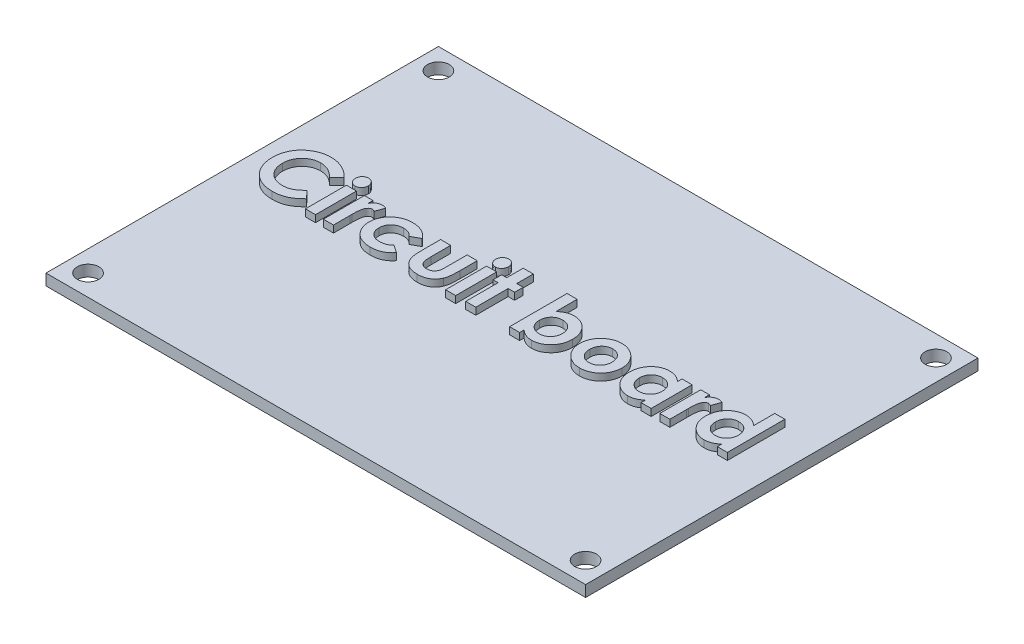
from build123d import *

# Parameters (mm, degrees)
SKETCH_1_W      = 77
SKETCH_1_H      = 56
SKETCH_1_R      = 1.55
EXTRUDE_1_DEPTH = 1.6
SKETCH_2_W      = 1.435897435
SKETCH_2_H      = 5.846153846
EXTRUDE_2_DEPTH = 1


with BuildPart() as part:
    # ｽｹｯﾁ1 → ﾎﾞｽ - 押し出し1 (new body)
    with BuildSketch(Plane(origin=(0, 0, 0), x_dir=(1, 0, 0), z_dir=(0, 1, 0))):
        Rectangle(SKETCH_1_W, SKETCH_1_H)
        with Locations(Location((-35.5, 25, 0), (0, 0, 270))):
            Circle(SKETCH_1_R, mode=Mode.SUBTRACT)
        with Locations(Location((35.5, 25, 0), (0, 0, 270))):
            Circle(SKETCH_1_R, mode=Mode.SUBTRACT)
        with Locations(Location((35.5, -25, 0), (0, 0, 270))):
            Circle(SKETCH_1_R, mode=Mode.SUBTRACT)
        with Locations(Location((-35.5, -25, 0), (0, 0, 270))):
            Circle(SKETCH_1_R, mode=Mode.SUBTRACT)
    extrude(amount=EXTRUDE_1_DEPTH)

    # ｽｹｯﾁ2 → ﾎﾞｽ - 押し出し2 (add)
    # profile 1 of 14: a face of its own
    with BuildSketch(Plane(origin=(0, 1.6, 0), x_dir=(1, 0, 0), z_dir=(0, 1, 0))):
        with BuildLine():
            Line((-28.050815975, 4.060532722), (-29.10370059, 3.054122466))
            add(Edge.make_bspline(
                [(-29.10370059, 3.054122466), (-29.193014841, 3.146473551), (-29.367473554, 3.326864152), (-29.648592194, 3.565685412), (-29.940945343, 3.764710617), (-30.238845856, 3.932328379), (-30.547652099, 4.059143161), (-30.86379343, 4.151555229), (-31.189288505, 4.207895374), (-31.409571052, 4.214341684), (-31.520367257, 4.217584004)],
                knots=[0, 0, 0, 0, 1.115251505, 2.178435587, 3.19620269, 4.182487026, 5.141301733, 6.088180966, 7.038406374, 8, 8, 8, 8], degree=3))
            add(Edge.make_bspline(
                [(-31.520367257, 4.217584004), (-31.612895552, 4.215022458), (-31.795489948, 4.209967528), (-32.063586371, 4.172909904), (-32.320034455, 4.109891803), (-32.565712062, 4.023041187), (-32.799896276, 3.910661099), (-33.023078093, 3.772838518), (-33.234707268, 3.610818179), (-33.431988301, 3.425438382), (-33.612454057, 3.222897024), (-33.771907043, 3.006785877), (-33.905474497, 2.777600041), (-34.015091133, 2.537660542), (-34.100478256, 2.28585682), (-34.161455389, 2.0223584), (-34.196722933, 1.746851475), (-34.201986851, 1.559563921), (-34.204662128, 1.464378876)],
                knots=[0, 0, 0, 0, 1.035432265, 2.043311493, 3.022114605, 3.98653278, 4.95457646, 5.923598177, 6.917315552, 7.932509744, 8.948865224, 9.949768934, 10.933144597, 11.912367597, 12.897413939, 13.903909035, 14.934704909, 16, 16, 16, 16], degree=3))
            add(Edge.make_bspline(
                [(-34.204662128, 1.464378876), (-34.203891144, 1.397571352), (-34.202371518, 1.265892349), (-34.18573652, 1.071102557), (-34.158950252, 0.882110409), (-34.120183886, 0.699202177), (-34.071706163, 0.522219351), (-34.014830757, 0.349635109), (-33.943481395, 0.183834176), (-33.864282528, 0.022890884), (-33.772175158, -0.128803229), (-33.672866422, -0.273456156), (-33.565182311, -0.410358822), (-33.448425349, -0.538951564), (-33.320952328, -0.657224767), (-33.186057953, -0.768735045), (-33.041466743, -0.87069092), (-32.890182223, -0.965651086), (-32.730897487, -1.04814379), (-32.567934299, -1.122866242), (-32.398821808, -1.183551983), (-32.225619061, -1.232470227), (-32.048945023, -1.274067888), (-31.867071658, -1.299680845), (-31.68157558, -1.319077239), (-31.556211367, -1.320274853), (-31.493123667, -1.320877534)],
                knots=[0, 0, 0, 0, 1.103660481, 2.175337485, 3.227646561, 4.255952547, 5.262355991, 6.258840057, 7.255597736, 8.242457506, 9.22035537, 10.185017736, 11.140346927, 12.096287581, 13.051739095, 14.01125915, 14.986044842, 15.97314143, 16.960198552, 17.947847494, 18.933482797, 19.925264591, 20.920966487, 21.929612487, 22.958107872, 24, 24, 24, 24], degree=3))
            add(Edge.make_bspline(
                [(-31.493123667, -1.320877534), (-31.386116085, -1.317782307), (-31.175874014, -1.311700991), (-30.867313544, -1.264145957), (-30.573286156, -1.185920619), (-30.33835968, -1.09354104), (-30.154300991, -1.002315006), (-30.014179832, -0.917935417), (-29.869283633, -0.823547582), (-29.722018996, -0.715589203), (-29.570729485, -0.595355822), (-29.418085709, -0.460214106), (-29.260179961, -0.314614076), (-29.15673747, -0.210696474), (-29.10370059, -0.157415996)],
                knots=[0, 0, 0, 0, 1.404581149, 2.759636711, 4.088442092, 5.392261763, 6.066678138, 6.783632037, 7.538459478, 8.336747902, 9.180226004, 10.074962426, 11.012997595, 12, 12, 12, 12], degree=3))
            Line((-29.10370059, -0.157415996), (-28.082867257, -1.22953138))
            add(Edge.make_bspline(
                [(-28.082867257, -1.22953138), (-28.154626345, -1.298812528), (-28.29468474, -1.434034511), (-28.505958941, -1.626037109), (-28.716967244, -1.798572787), (-28.922612129, -1.957903835), (-29.126262275, -2.099388551), (-29.327896083, -2.223168239), (-29.525230971, -2.332373466), (-29.722364662, -2.425162539), (-29.920523822, -2.503950099), (-30.124406312, -2.571781017), (-30.334635418, -2.629163533), (-30.552495124, -2.675463688), (-30.775953368, -2.712590161), (-31.007101422, -2.737650316), (-31.244473692, -2.754497424), (-31.405486981, -2.756011276), (-31.486713411, -2.75677497)],
                knots=[0, 0, 0, 0, 1.244526981, 2.429050516, 3.560637417, 4.644440555, 5.67424972, 6.652764056, 7.595344123, 8.486817594, 9.369275933, 10.254498637, 11.166417451, 12.086725134, 13.032340136, 13.991389299, 14.986715468, 16, 16, 16, 16], degree=3))
            add(Edge.make_bspline(
                [(-31.486713411, -2.75677497), (-31.6359163, -2.752971491), (-31.92786488, -2.745529139), (-32.355707912, -2.690386353), (-32.762147308, -2.597940444), (-33.148171859, -2.46719643), (-33.513658817, -2.300177079), (-33.858514681, -2.095419197), (-34.182183618, -1.853466794), (-34.482051022, -1.577155787), (-34.75329536, -1.271993476), (-34.993043943, -0.944332872), (-35.191363979, -0.592563643), (-35.356033379, -0.221882545), (-35.484802684, 0.169401984), (-35.575434445, 0.581713195), (-35.631326391, 1.014652976), (-35.637441049, 1.310360826), (-35.640559564, 1.461173748)],
                knots=[0, 0, 0, 0, 1.078019885, 2.10938526, 3.111377082, 4.085535484, 5.04941344, 6.010039228, 6.978205633, 7.964457913, 8.951525778, 9.924444315, 10.892603023, 11.863865945, 12.85144698, 13.863884204, 14.910567087, 16, 16, 16, 16], degree=3))
            add(Edge.make_bspline(
                [(-35.640559564, 1.461173748), (-35.639241831, 1.559532649), (-35.636630405, 1.754455951), (-35.60918408, 2.041593767), (-35.570922306, 2.321501777), (-35.510223482, 2.591273607), (-35.437057035, 2.854543582), (-35.346064946, 3.108450266), (-35.237392541, 3.35372341), (-35.114542588, 3.590773617), (-34.975563666, 3.818047955), (-34.820308952, 4.033593778), (-34.652775309, 4.239075061), (-34.468937176, 4.431765712), (-34.271465962, 4.613357594), (-34.059470108, 4.782866625), (-33.834224662, 4.942723756), (-33.595119969, 5.088806659), (-33.346801196, 5.22094641), (-33.092400296, 5.337499314), (-32.832542302, 5.434910701), (-32.568325918, 5.515709854), (-32.298634833, 5.576020708), (-32.025394033, 5.621674079), (-31.746278567, 5.647194605), (-31.558876712, 5.651372478), (-31.464277513, 5.65348144)],
                knots=[0, 0, 0, 0, 1.071919942, 2.124283339, 3.142214191, 4.149696895, 5.136002878, 6.119640489, 7.086990633, 8.058538607, 9.028339693, 9.988281803, 10.952401235, 11.916291999, 12.888973767, 13.874849856, 14.873389453, 15.898127285, 16.927174885, 17.938320013, 18.946391617, 19.950418109, 20.947802303, 21.956882652, 22.968648068, 24, 24, 24, 24], degree=3))
            add(Edge.make_bspline(
                [(-31.464277513, 5.65348144), (-31.383574697, 5.65227253), (-31.223008148, 5.64986728), (-30.983897613, 5.629816902), (-30.746699373, 5.598327986), (-30.512262669, 5.550817917), (-30.27891057, 5.494417461), (-30.049709585, 5.420568845), (-29.821043945, 5.338250645), (-29.596499929, 5.239856045), (-29.375764109, 5.132449451), (-29.164007567, 5.010592771), (-28.957674932, 4.881784926), (-28.76133841, 4.738402506), (-28.571320195, 4.585646257), (-28.38861391, 4.422803485), (-28.21482291, 4.247159124), (-28.105761327, 4.123056014), (-28.050815975, 4.060532722)],
                knots=[0, 0, 0, 0, 0.996412454, 1.982464992, 2.961075852, 3.949442424, 4.934965278, 5.923860011, 6.921385422, 7.934793307, 8.949617135, 9.951082467, 10.950285876, 11.951772932, 12.951063433, 13.960125323, 14.972308753, 16, 16, 16, 16], degree=3))
        make_face()
    # profile 2 of 14: a face of its own
    with BuildSketch(Plane(origin=(0, 1.6, 0), x_dir=(1, 0, 0), z_dir=(0, 1, 0))):
        with BuildLine():
            add(Edge.make_bspline(
                [(-26.207867257, 5.756045543), (-26.145980087, 5.753009124), (-26.024458668, 5.747046823), (-25.850362697, 5.688927654), (-25.69057788, 5.597711354), (-25.54932367, 5.472560416), (-25.431841627, 5.323107306), (-25.342080982, 5.155784613), (-25.292079067, 4.970396457), (-25.28513454, 4.842332259), (-25.281585205, 4.776878876)],
                knots=[0, 0, 0, 0, 0.989868614, 1.943702388, 2.910836514, 3.924849579, 4.949916355, 5.946401046, 6.950409252, 8, 8, 8, 8], degree=3))
            add(Edge.make_bspline(
                [(-25.281585205, 4.776878876), (-25.285007551, 4.711907849), (-25.291676155, 4.585308708), (-25.343231807, 4.402437284), (-25.429389771, 4.235195859), (-25.547823346, 4.087962405), (-25.687546175, 3.964827097), (-25.843839572, 3.87195482), (-26.016267198, 3.817068807), (-26.135902972, 3.810608091), (-26.196649308, 3.807327594)],
                knots=[0, 0, 0, 0, 1.05296456, 2.051751585, 3.055639087, 4.085634717, 5.099016424, 6.062201612, 7.016062274, 8, 8, 8, 8], degree=3))
            add(Edge.make_bspline(
                [(-26.196649308, 3.807327594), (-26.259076701, 3.810353158), (-26.381655352, 3.816293973), (-26.557179268, 3.874549128), (-26.719095206, 3.96504704), (-26.859736656, 4.092755006), (-26.978564131, 4.243270093), (-27.064403995, 4.414488204), (-27.118098954, 4.601144039), (-27.124472498, 4.731104955), (-27.127739052, 4.797712209)],
                knots=[0, 0, 0, 0, 0.989065327, 1.942068821, 2.907541208, 3.917690034, 4.939857478, 5.938239964, 6.943311734, 8, 8, 8, 8], degree=3))
            add(Edge.make_bspline(
                [(-27.127739052, 4.797712209), (-27.124184148, 4.86157999), (-27.117201054, 4.987039024), (-27.066899621, 5.168305458), (-26.979197186, 5.332815195), (-26.862561377, 5.479532426), (-26.722547855, 5.602348828), (-26.562858958, 5.690794829), (-26.38993466, 5.746513511), (-26.269183035, 5.752835391), (-26.207867257, 5.756045543)],
                knots=[0, 0, 0, 0, 1.038616768, 2.040212704, 3.031499824, 4.052181184, 5.074969369, 6.039807101, 7.004644834, 8, 8, 8, 8], degree=3))
        make_face()
    # profile 3 of 14: a face of its own
    with BuildSketch(Plane(origin=(0, 1.6, 0), x_dir=(1, 0, 0), z_dir=(0, 1, 0))):
        with Locations((-26.204662129, 0.371430158)):
            Rectangle(SKETCH_2_W, SKETCH_2_H)
    # profile 4 of 14: a face of its own
    with BuildSketch(Plane(origin=(0, 1.6, 0), x_dir=(1, 0, 0), z_dir=(0, 1, 0))):
        with BuildLine():
            Line((-24.358508282, 3.294507081), (-23.127739052, 3.294507081))
            Line((-23.127739052, 3.294507081), (-23.127739052, 2.574955799))
            add(Edge.make_bspline(
                [(-23.127739052, 2.574955799), (-23.092922953, 2.63890252), (-23.024873443, 2.763889038), (-22.899860787, 2.931658686), (-22.756241185, 3.072949604), (-22.599175332, 3.190717018), (-22.428187193, 3.282505154), (-22.247855526, 3.347915772), (-22.059723065, 3.39042361), (-21.931385478, 3.39483937), (-21.866521103, 3.397071184)],
                knots=[0, 0, 0, 0, 1.09866127, 2.147379032, 3.14564304, 4.131443017, 5.102343063, 6.064490016, 7.021754664, 8, 8, 8, 8], degree=3))
            add(Edge.make_bspline(
                [(-21.866521103, 3.397071184), (-21.819421473, 3.394865686), (-21.723509807, 3.390374505), (-21.577326933, 3.364267199), (-21.429034896, 3.317060227), (-21.331445957, 3.274556622), (-21.281585205, 3.252840415)],
                knots=[0, 0, 0, 0, 0.931404136, 1.896671404, 2.925354185, 4, 4, 4, 4], degree=3))
            Line((-21.281585205, 3.252840415), (-21.727098026, 2.036494261))
            add(Edge.make_bspline(
                [(-21.727098026, 2.036494261), (-21.76692051, 2.05573456), (-21.841771451, 2.091898915), (-21.95044202, 2.13457658), (-22.049065067, 2.160616406), (-22.111590269, 2.164501776), (-22.140559564, 2.166301953)],
                knots=[0, 0, 0, 0, 1.214386998, 2.282580073, 3.20428172, 4, 4, 4, 4], degree=3))
            add(Edge.make_bspline(
                [(-22.140559564, 2.166301953), (-22.167912213, 2.165109061), (-22.221719586, 2.162762436), (-22.301137764, 2.142652656), (-22.375933149, 2.107973965), (-22.449710127, 2.06354712), (-22.516648513, 2.001790482), (-22.583545553, 1.930296209), (-22.642498806, 1.842027019), (-22.704711586, 1.743778928), (-22.757683543, 1.623523353), (-22.803105365, 1.479962979), (-22.843576573, 1.311436712), (-22.87142629, 1.117049761), (-22.89834416, 0.898683156), (-22.914366336, 0.654734112), (-22.926307868, 0.38597402), (-22.927038012, 0.198369776), (-22.927418539, 0.100596825)],
                knots=[0, 0, 0, 0, 0.544232178, 1.070598461, 1.618251235, 2.182094276, 2.777567932, 3.425210017, 4.127676488, 4.886675562, 5.738955394, 6.734782583, 7.883056018, 9.186093582, 10.642914445, 12.264202625, 14.053029461, 16, 16, 16, 16], degree=3))
            Line((-22.927418539, 0.100596825), (-22.922610846, -0.184659585))
            Line((-22.922610846, -0.184659585), (-22.922610846, -2.551646765))
            Line((-22.922610846, -2.551646765), (-24.358508282, -2.551646765))
            Line((-24.358508282, -2.551646765), (-24.358508282, 3.294507081))
        make_face()
    # profile 5 of 14: a face of its own
    with BuildSketch(Plane(origin=(0, 1.6, 0), x_dir=(1, 0, 0), z_dir=(0, 1, 0))):
        with BuildLine():
            Line((-14.922610846, 2.102199389), (-16.111713411, 1.448353235))
            add(Edge.make_bspline(
                [(-16.111713411, 1.448353235), (-16.166217538, 1.502934317), (-16.270988174, 1.607852878), (-16.43899631, 1.740663132), (-16.604002361, 1.850626327), (-16.772808843, 1.931773516), (-16.946924687, 1.992885128), (-17.132630039, 2.033360691), (-17.332092408, 2.060012411), (-17.470060756, 2.062470434), (-17.54120059, 2.06373785)],
                knots=[0, 0, 0, 0, 1.150764855, 2.212059359, 3.192108068, 4.105322427, 5.000809612, 5.941206042, 6.938435785, 8, 8, 8, 8], degree=3))
            add(Edge.make_bspline(
                [(-17.54120059, 2.06373785), (-17.606440728, 2.06216206), (-17.734110206, 2.059078371), (-17.920655574, 2.036045328), (-18.09794783, 1.999869201), (-18.265668725, 1.946943401), (-18.423519532, 1.877025537), (-18.572805609, 1.794288263), (-18.712076287, 1.695499971), (-18.839362938, 1.582064913), (-18.954261513, 1.457175428), (-19.056756903, 1.323975426), (-19.140724833, 1.180488914), (-19.213320316, 1.030088348), (-19.266693401, 0.869948868), (-19.305742448, 0.701523572), (-19.328000041, 0.524804999), (-19.331224774, 0.404076023), (-19.332867257, 0.342584004)],
                knots=[0, 0, 0, 0, 1.121765476, 2.195200973, 3.227634963, 4.230038321, 5.213228299, 6.192116585, 7.160777141, 8.14345191, 9.118668839, 10.075979138, 11.027630062, 11.972829041, 12.943187208, 13.923755399, 14.94248691, 16, 16, 16, 16], degree=3))
            add(Edge.make_bspline(
                [(-19.332867257, 0.342584004), (-19.331131832, 0.282696724), (-19.327743292, 0.165762568), (-19.306925245, -0.006041573), (-19.270784333, -0.169591785), (-19.216595765, -0.324023424), (-19.151644708, -0.470760132), (-19.070078072, -0.608634881), (-18.9741602, -0.738249738), (-18.863386126, -0.858478159), (-18.740676562, -0.966608872), (-18.608386031, -1.062099487), (-18.466909233, -1.143057862), (-18.314598104, -1.206591991), (-18.153935924, -1.258359015), (-17.983849785, -1.295219163), (-17.804520688, -1.315679095), (-17.682276582, -1.319117935), (-17.619726231, -1.320877534)],
                knots=[0, 0, 0, 0, 1.070556293, 2.090336998, 3.088792742, 4.058148387, 5.011235098, 5.952916408, 6.915475435, 7.888633318, 8.869583867, 9.83422472, 10.800707077, 11.776204622, 12.778807041, 13.814557445, 14.881744048, 16, 16, 16, 16], degree=3))
            add(Edge.make_bspline(
                [(-17.619726231, -1.320877534), (-17.542711757, -1.319115218), (-17.392390695, -1.315675432), (-17.173867496, -1.286500278), (-16.968240156, -1.238254831), (-16.775486868, -1.171479302), (-16.595877299, -1.084169053), (-16.42987294, -0.977526097), (-16.275767274, -0.852337124), (-16.185901339, -0.754736981), (-16.140559564, -0.705492919)],
                knots=[0, 0, 0, 0, 1.116373375, 2.178998604, 3.189797796, 4.174590301, 5.13072713, 6.078291395, 7.030403691, 8, 8, 8, 8], degree=3))
            Line((-16.140559564, -0.705492919), (-15.025174949, -1.47151856))
            add(Edge.make_bspline(
                [(-15.025174949, -1.47151856), (-15.102488053, -1.566043606), (-15.255059585, -1.752581598), (-15.521254601, -1.993022259), (-15.80776084, -2.199614213), (-16.120340561, -2.364513292), (-16.454441571, -2.49566943), (-16.812674548, -2.588383798), (-17.194433567, -2.642960796), (-17.456618944, -2.650400902), (-17.590880077, -2.654210867)],
                knots=[0, 0, 0, 0, 0.997876357, 1.969233105, 2.924898516, 3.881013542, 4.852507933, 5.855329832, 6.901747111, 8, 8, 8, 8], degree=3))
            add(Edge.make_bspline(
                [(-17.590880077, -2.654210867), (-17.711723424, -2.651417328), (-17.947743805, -2.645961237), (-18.291737646, -2.604177875), (-18.615281716, -2.533799489), (-18.919041595, -2.436058377), (-19.202740342, -2.309447036), (-19.465457896, -2.152401667), (-19.708966282, -1.969290698), (-19.928871632, -1.759249121), (-20.125077662, -1.530616597), (-20.296366234, -1.289830198), (-20.444504426, -1.041204114), (-20.560718692, -0.780600061), (-20.655697778, -0.512079995), (-20.719843671, -0.232434141), (-20.762151838, 0.056034022), (-20.766542666, 0.25161894), (-20.768764693, 0.350596825)],
                knots=[0, 0, 0, 0, 1.183377041, 2.311265848, 3.387807024, 4.421911742, 5.431260577, 6.423665966, 7.413571885, 8.409103097, 9.395976332, 10.359992013, 11.300391101, 12.225292883, 13.150239058, 14.085544813, 15.031169026, 16, 16, 16, 16], degree=3))
            add(Edge.make_bspline(
                [(-20.768764693, 0.350596825), (-20.767574337, 0.419555557), (-20.765216608, 0.556141602), (-20.745089062, 0.758987111), (-20.713777364, 0.958390413), (-20.666719577, 1.152951801), (-20.608846807, 1.343615216), (-20.538494619, 1.530342332), (-20.452888061, 1.712169606), (-20.357393688, 1.890643768), (-20.248556696, 2.061053366), (-20.129817796, 2.223323187), (-20.00134428, 2.376459405), (-19.861626909, 2.519034832), (-19.711639881, 2.652069651), (-19.553563619, 2.778262893), (-19.382282851, 2.891106483), (-19.20375196, 2.9972003), (-19.016433084, 3.091644232), (-18.8224792, 3.173161796), (-18.623389137, 3.242422723), (-18.418685685, 3.298109907), (-18.209247475, 3.344006355), (-17.993210875, 3.373134128), (-17.772363225, 3.393607414), (-17.622979977, 3.395909633), (-17.547610846, 3.397071184)],
                knots=[0, 0, 0, 0, 1.00272354, 1.986087015, 2.96193297, 3.936200312, 4.894695956, 5.858592327, 6.835334787, 7.815655071, 8.800643866, 9.773423113, 10.738352213, 11.705312252, 12.673769326, 13.65298065, 14.64420052, 15.654211674, 16.672258995, 17.692438602, 18.712115155, 19.735602823, 20.776372304, 21.827874031, 22.90408564, 24, 24, 24, 24], degree=3))
            add(Edge.make_bspline(
                [(-17.547610846, 3.397071184), (-17.477602593, 3.396279681), (-17.339531515, 3.39471867), (-17.135631743, 3.37839613), (-16.937293942, 3.350671579), (-16.744180579, 3.313993166), (-16.55570517, 3.268542225), (-16.374393787, 3.207957643), (-16.197767596, 3.139196423), (-15.970271197, 3.035374162), (-15.702094581, 2.880402632), (-15.407708505, 2.658139296), (-15.145227681, 2.39812361), (-14.997210869, 2.201365086), (-14.922610846, 2.102199389)],
                knots=[0, 0, 0, 0, 0.826738014, 1.630502179, 2.413926014, 3.191023582, 3.95155221, 4.701751672, 5.446919844, 6.189438973, 7.653650558, 9.094719814, 10.535747635, 12, 12, 12, 12], degree=3))
        make_face()
    # profile 6 of 14: a face of its own
    with BuildSketch(Plane(origin=(0, 1.6, 0), x_dir=(1, 0, 0), z_dir=(0, 1, 0))):
        with BuildLine():
            Line((-13.486713411, 3.294507081), (-12.050815975, 3.294507081))
            Line((-12.050815975, 3.294507081), (-12.050815975, 0.488417338))
            add(Edge.make_bspline(
                [(-12.050815975, 0.488417338), (-12.050688466, 0.422705489), (-12.050443746, 0.296588405), (-12.043633992, 0.115459581), (-12.034078561, -0.050174435), (-12.022154029, -0.200508955), (-12.004355901, -0.335182374), (-11.983808712, -0.453937598), (-11.960514829, -0.557630271), (-11.922636033, -0.673209581), (-11.863373973, -0.799688906), (-11.773877772, -0.933961563), (-11.665471769, -1.05006815), (-11.539620603, -1.149039054), (-11.395039023, -1.227030299), (-11.233718986, -1.279883776), (-11.057690225, -1.315406808), (-10.935086457, -1.319005898), (-10.871328795, -1.320877534)],
                knots=[0, 0, 0, 0, 1.267339619, 2.432334223, 3.495366327, 4.467371443, 5.340232306, 6.114347373, 6.791623365, 7.387877112, 8.457231658, 9.474542289, 10.487879852, 11.508108106, 12.54995813, 13.638205937, 14.771795776, 16, 16, 16, 16], degree=3))
            add(Edge.make_bspline(
                [(-10.871328795, -1.320877534), (-10.807627713, -1.318741327), (-10.684706871, -1.314619192), (-10.507506923, -1.282473691), (-10.345806914, -1.227391304), (-10.197946081, -1.152678547), (-10.068284849, -1.052688248), (-9.955394117, -0.933542712), (-9.86034277, -0.793319976), (-9.814666215, -0.688717834), (-9.79120059, -0.634980098)],
                knots=[0, 0, 0, 0, 1.116871431, 2.155171802, 3.144773418, 4.104381479, 5.046960687, 6.001340237, 6.973219418, 8, 8, 8, 8], degree=3))
            add(Edge.make_bspline(
                [(-9.79120059, -0.634980098), (-9.782589494, -0.611109314), (-9.763581493, -0.558417312), (-9.746663996, -0.467516357), (-9.728455731, -0.360313398), (-9.714052347, -0.23462373), (-9.705902404, -0.09122576), (-9.697170575, 0.070061241), (-9.692720677, 0.249076643), (-9.692143609, 0.374633578), (-9.691841616, 0.440340415)],
                knots=[0, 0, 0, 0, 0.56094539, 1.238222264, 2.041156151, 2.969685991, 4.036367568, 5.220421584, 6.545382566, 8, 8, 8, 8], degree=3))
            Line((-9.691841616, 0.440340415), (-9.691841616, 3.294507081))
            Line((-9.691841616, 3.294507081), (-8.25594418, 3.294507081))
            Line((-8.25594418, 3.294507081), (-8.25594418, 0.837776312))
            add(Edge.make_bspline(
                [(-8.25594418, 0.837776312), (-8.256192804, 0.715966391), (-8.256669492, 0.482419903), (-8.270331075, 0.147405057), (-8.289185608, -0.157190306), (-8.313466619, -0.432204831), (-8.348452556, -0.677752652), (-8.391399658, -0.893257953), (-8.438912864, -1.080144821), (-8.482484245, -1.190876582), (-8.502739052, -1.242351893)],
                knots=[0, 0, 0, 0, 1.388070971, 2.661352173, 3.82033814, 4.865898334, 5.806910977, 6.645039373, 7.370126333, 8, 8, 8, 8], degree=3))
            add(Edge.make_bspline(
                [(-8.502739052, -1.242351893), (-8.528700497, -1.297755232), (-8.579946159, -1.407116663), (-8.66886691, -1.562604399), (-8.76472846, -1.70991671), (-8.872091938, -1.845586009), (-8.988765724, -1.970991157), (-9.111451815, -2.088982918), (-9.245675356, -2.194756489), (-9.387955435, -2.291033722), (-9.540277372, -2.37649821), (-9.701597874, -2.452234223), (-9.873660266, -2.51387035), (-10.054972561, -2.566115662), (-10.246370492, -2.605077678), (-10.44746851, -2.634588433), (-10.65848717, -2.649839703), (-10.802397988, -2.652729939), (-10.876136487, -2.654210867)],
                knots=[0, 0, 0, 0, 0.997311338, 1.968606903, 2.91805772, 3.860812155, 4.785445165, 5.709667791, 6.633356648, 7.568312411, 8.508286151, 9.478643871, 10.470653671, 11.485274776, 12.552984541, 13.653035246, 14.797438149, 16, 16, 16, 16], degree=3))
            add(Edge.make_bspline(
                [(-10.876136487, -2.654210867), (-10.955794788, -2.653261551), (-11.111659069, -2.65140406), (-11.339374607, -2.628657075), (-11.556390576, -2.599225434), (-11.760284007, -2.549186249), (-11.953902365, -2.49121335), (-12.135022804, -2.417224511), (-12.304385425, -2.3302346), (-12.462323474, -2.230759342), (-12.60761204, -2.117887152), (-12.743481776, -1.99649704), (-12.865546225, -1.86175928), (-12.977790293, -1.717834626), (-13.078961273, -1.56339847), (-13.169109381, -1.398999939), (-13.248310976, -1.223891266), (-13.290568956, -1.10116509), (-13.312033923, -1.038826252)],
                knots=[0, 0, 0, 0, 1.211240017, 2.369985978, 3.478996442, 4.539426614, 5.559871561, 6.551301256, 7.510778031, 8.453136967, 9.386094087, 10.30661716, 11.221130616, 12.147659962, 13.080758632, 14.026335491, 14.997475882, 16, 16, 16, 16], degree=3))
            add(Edge.make_bspline(
                [(-13.312033923, -1.038826252), (-13.326678024, -0.990411524), (-13.35822483, -0.886114915), (-13.392285715, -0.712786123), (-13.41952885, -0.513014985), (-13.44603011, -0.286604998), (-13.464517874, -0.033176587), (-13.476601695, 0.246867773), (-13.48476636, 0.554075705), (-13.486045273, 0.767792025), (-13.486713411, 0.879442979)],
                knots=[0, 0, 0, 0, 0.627914866, 1.352675004, 2.190563461, 3.132055958, 4.183353232, 5.345633452, 6.613289997, 8, 8, 8, 8], degree=3))
            Line((-13.486713411, 0.879442979), (-13.486713411, 3.294507081))
        make_face()
    # profile 7 of 14: a face of its own
    with BuildSketch(Plane(origin=(0, 1.6, 0), x_dir=(1, 0, 0), z_dir=(0, 1, 0))):
        with BuildLine():
            add(Edge.make_bspline(
                [(-6.207867257, 5.756045543), (-6.145980087, 5.753009124), (-6.024458668, 5.747046823), (-5.850362697, 5.688927654), (-5.69057788, 5.597711354), (-5.54932367, 5.472560416), (-5.431841627, 5.323107306), (-5.342080982, 5.155784613), (-5.292079067, 4.970396457), (-5.28513454, 4.842332259), (-5.281585205, 4.776878876)],
                knots=[0, 0, 0, 0, 0.989868614, 1.943702388, 2.910836514, 3.924849579, 4.949916355, 5.946401046, 6.950409252, 8, 8, 8, 8], degree=3))
            add(Edge.make_bspline(
                [(-5.281585205, 4.776878876), (-5.285007551, 4.711907849), (-5.291676155, 4.585308708), (-5.343231807, 4.402437284), (-5.429389771, 4.235195859), (-5.547823346, 4.087962405), (-5.687546175, 3.964827097), (-5.843839572, 3.87195482), (-6.016267198, 3.817068807), (-6.135902972, 3.810608091), (-6.196649308, 3.807327594)],
                knots=[0, 0, 0, 0, 1.05296456, 2.051751585, 3.055639087, 4.085634717, 5.099016424, 6.062201612, 7.016062274, 8, 8, 8, 8], degree=3))
            add(Edge.make_bspline(
                [(-6.196649308, 3.807327594), (-6.259076701, 3.810353158), (-6.381655352, 3.816293973), (-6.557179268, 3.874549128), (-6.719095206, 3.96504704), (-6.859736656, 4.092755006), (-6.978564131, 4.243270093), (-7.064403995, 4.414488204), (-7.118098954, 4.601144039), (-7.124472498, 4.731104955), (-7.127739052, 4.797712209)],
                knots=[0, 0, 0, 0, 0.989065327, 1.942068821, 2.907541208, 3.917690034, 4.939857478, 5.938239964, 6.943311734, 8, 8, 8, 8], degree=3))
            add(Edge.make_bspline(
                [(-7.127739052, 4.797712209), (-7.124184148, 4.86157999), (-7.117201054, 4.987039024), (-7.066899621, 5.168305458), (-6.979197186, 5.332815195), (-6.862561377, 5.479532426), (-6.722547855, 5.602348828), (-6.562858958, 5.690794829), (-6.38993466, 5.746513511), (-6.269183035, 5.752835391), (-6.207867257, 5.756045543)],
                knots=[0, 0, 0, 0, 1.038616768, 2.040212704, 3.031499824, 4.052181184, 5.074969369, 6.039807101, 7.004644834, 8, 8, 8, 8], degree=3))
        make_face()
    # profile 8 of 14: a face of its own
    with BuildSketch(Plane(origin=(0, 1.6, 0), x_dir=(1, 0, 0), z_dir=(0, 1, 0))):
        with Locations((-6.204662129, 0.371430158)):
            Rectangle(SKETCH_2_W, SKETCH_2_H)
    # profile 9 of 14: a face of its own
    with BuildSketch(Plane(origin=(0, 1.6, 0), x_dir=(1, 0, 0), z_dir=(0, 1, 0))):
        Polygon((-4.050815975, 5.65348144), (-2.614918539, 5.65348144), (-2.614918539, 3.294507081), (-1.691841616, 3.294507081), (-1.691841616, 2.06373785), (-2.614918539, 2.06373785), (-2.614918539, -2.551646765), (-4.050815975, -2.551646765), (-4.050815975, 2.06373785), (-4.768764693, 2.06373785), (-4.768764693, 3.294507081), (-4.050815975, 3.294507081), align=None)
    # profile 10 of 14: a face of its own
    with BuildSketch(Plane(origin=(0, 1.6, 0), x_dir=(1, 0, 0), z_dir=(0, 1, 0))):
        with BuildLine():
            Line((3.641491718, 5.65348144), (3.641491718, 2.613417338))
            add(Edge.make_bspline(
                [(3.641491718, 2.613417338), (3.708168228, 2.67619729), (3.839057767, 2.799437681), (4.052763646, 2.958800994), (4.274137484, 3.093302324), (4.502980961, 3.206142648), (4.74135369, 3.289583202), (4.986326831, 3.354419638), (5.240410553, 3.388758382), (5.412236637, 3.394284943), (5.498863513, 3.397071184)],
                knots=[0, 0, 0, 0, 1.061187343, 2.083167259, 3.083809127, 4.061667593, 5.035358583, 6.007314429, 6.995378812, 8, 8, 8, 8], degree=3))
            add(Edge.make_bspline(
                [(5.498863513, 3.397071184), (5.5930281, 3.394815705), (5.778501784, 3.390373142), (6.051391019, 3.348895441), (6.312906077, 3.281849591), (6.564044184, 3.188235311), (6.803467302, 3.066692803), (7.033865523, 2.921168599), (7.251265357, 2.74565757), (7.45577249, 2.546861903), (7.644946683, 2.328967083), (7.809493392, 2.092069169), (7.946554414, 1.839286192), (8.062720365, 1.573606574), (8.147502942, 1.290624107), (8.212846278, 0.994134811), (8.249259252, 0.681630324), (8.254304395, 0.468740328), (8.256876333, 0.360212209)],
                knots=[0, 0, 0, 0, 0.985987466, 1.942075377, 2.884088208, 3.810275091, 4.743821533, 5.692411115, 6.659945104, 7.665215984, 8.677116751, 9.678438675, 10.680260931, 11.685531812, 12.710472044, 13.769734641, 14.863044265, 16, 16, 16, 16], degree=3))
            add(Edge.make_bspline(
                [(8.256876333, 0.360212209), (8.254442165, 0.255399298), (8.249643884, 0.04878994), (8.210876794, -0.2545296), (8.145169824, -0.544285745), (8.052996261, -0.82058285), (7.935818829, -1.084294062), (7.792795685, -1.335237667), (7.623092546, -1.572537128), (7.429078064, -1.792995778), (7.217089049, -1.992637475), (6.99621169, -2.17175577), (6.762046836, -2.318529167), (6.520448087, -2.442490544), (6.267609345, -2.537281411), (6.00525761, -2.603693067), (5.733808384, -2.648093379), (5.549255973, -2.652151395), (5.455594282, -2.654210867)],
                knots=[0, 0, 0, 0, 1.098553145, 2.165490463, 3.199345634, 4.208780719, 5.21409072, 6.219899742, 7.23156933, 8.267303578, 9.293302409, 10.281606823, 11.243293419, 12.184993323, 13.124258899, 14.066907486, 15.018941492, 16, 16, 16, 16], degree=3))
            add(Edge.make_bspline(
                [(5.455594282, -2.654210867), (5.372162778, -2.651980523), (5.207880082, -2.647588813), (4.96572055, -2.615016511), (4.733014032, -2.560236175), (4.50682089, -2.484775908), (4.286527391, -2.381674998), (4.068297118, -2.252760797), (3.850725587, -2.096402244), (3.712640279, -1.975909983), (3.641491718, -1.913826252)],
                knots=[0, 0, 0, 0, 0.996418773, 1.962021009, 2.912343664, 3.848616743, 4.805003894, 5.811808768, 6.872532775, 8, 8, 8, 8], degree=3))
            Line((3.641491718, -1.913826252), (3.641491718, -2.551646765))
            Line((3.641491718, -2.551646765), (2.205594282, -2.551646765))
            Line((2.205594282, -2.551646765), (2.205594282, 5.65348144))
            Line((2.205594282, 5.65348144), (3.641491718, 5.65348144))
        make_face()
        with BuildLine():
            add(Edge.make_bspline(
                [(5.187966077, 2.06373785), (5.129693075, 2.061945916), (5.015446313, 2.058432749), (4.847711259, 2.038298808), (4.688779342, 2.00041665), (4.536234131, 1.951317494), (4.392007287, 1.885041345), (4.254918871, 1.804701029), (4.12614306, 1.708901335), (4.005011508, 1.601435813), (3.896165178, 1.480536898), (3.799464656, 1.351350138), (3.719238692, 1.212193275), (3.652361607, 1.064830805), (3.601905768, 0.907668278), (3.564482153, 0.74204268), (3.544144791, 0.567446443), (3.540694179, 0.448401596), (3.538927615, 0.387455799)],
                knots=[0, 0, 0, 0, 1.060469436, 2.079096586, 3.066888298, 4.028858836, 4.99004353, 5.948472697, 6.914558426, 7.905691313, 8.889602648, 9.869280844, 10.836099585, 11.806137001, 12.808075328, 13.83377171, 14.890985086, 16, 16, 16, 16], degree=3))
            add(Edge.make_bspline(
                [(3.538927615, 0.387455799), (3.540716408, 0.325443401), (3.54422699, 0.203741399), (3.564394814, 0.02542213), (3.601555753, -0.143521713), (3.653074286, -0.30347317), (3.718813368, -0.454452994), (3.79894428, -0.597020889), (3.896709224, -0.728051126), (4.004359837, -0.852137624), (4.126240375, -0.961041058), (4.254436049, -1.058712457), (4.391973982, -1.13917253), (4.536890091, -1.204364207), (4.688084765, -1.258538134), (4.847811094, -1.2951434), (5.015419822, -1.315650735), (5.129684127, -1.319112048), (5.187966077, -1.320877534)],
                knots=[0, 0, 0, 0, 1.117193555, 2.192540452, 3.22680955, 4.227918444, 5.21468246, 6.188555072, 7.166222992, 8.154674427, 9.142376254, 10.104580718, 11.053462639, 12.005072638, 12.963662044, 13.941614018, 14.950094269, 16, 16, 16, 16], degree=3))
            add(Edge.make_bspline(
                [(5.187966077, -1.320877534), (5.244128039, -1.319237451), (5.355296507, -1.315991028), (5.517954809, -1.293338626), (5.674309962, -1.256322348), (5.823137498, -1.203560763), (5.965343387, -1.134865233), (6.102222233, -1.054480092), (6.229048462, -0.954044861), (6.350797678, -0.843657967), (6.459730701, -0.719173299), (6.557456714, -0.586924734), (6.639549468, -0.445731928), (6.704729181, -0.295126665), (6.758615108, -0.137961626), (6.79540473, 0.028639851), (6.815645706, 0.20319073), (6.819183505, 0.322234682), (6.820978897, 0.382648107)],
                knots=[0, 0, 0, 0, 1.021711385, 2.02240246, 2.981887075, 3.941027022, 4.888772411, 5.852236371, 6.822344989, 7.82661704, 8.838806642, 9.826383926, 10.814965113, 11.80282933, 12.807900643, 13.833672313, 14.900613836, 16, 16, 16, 16], degree=3))
            add(Edge.make_bspline(
                [(6.820978897, 0.382648107), (6.819154833, 0.442518014), (6.815560917, 0.560478493), (6.795734434, 0.733575831), (6.757528355, 0.897755209), (6.709288318, 1.054357855), (6.641892662, 1.201345208), (6.562204093, 1.340456107), (6.468435729, 1.472110587), (6.359660386, 1.59275462), (6.240353006, 1.702532024), (6.112994411, 1.799631042), (5.978084748, 1.882289973), (5.833786844, 1.947475902), (5.683505901, 2.001109874), (5.524945313, 2.038053662), (5.358911188, 2.058500421), (5.245713095, 2.061968593), (5.187966077, 2.06373785)],
                knots=[0, 0, 0, 0, 1.094680664, 2.156827393, 3.177782763, 4.17210342, 5.146667393, 6.126451192, 7.099203661, 8.094961544, 9.09004898, 10.058676268, 11.018205477, 11.974998356, 12.947750825, 13.930643515, 14.944335875, 16, 16, 16, 16], degree=3))
        make_face(mode=Mode.SUBTRACT)
    # profile 11 of 14: a face of its own
    with BuildSketch(Plane(origin=(0, 1.6, 0), x_dir=(1, 0, 0), z_dir=(0, 1, 0))):
        with BuildLine():
            add(Edge.make_bspline(
                [(12.272901974, 3.397071184), (12.340788433, 3.395863098), (12.475234382, 3.39347054), (12.675474828, 3.373554682), (12.872214609, 3.341061139), (13.066584559, 3.298987673), (13.256779772, 3.240036454), (13.443797799, 3.169333582), (13.629310818, 3.088158417), (13.808714433, 2.991531577), (13.983304701, 2.886730957), (14.148826666, 2.771127274), (14.303905782, 2.645628556), (14.451420845, 2.513144589), (14.584497415, 2.367907454), (14.711639799, 2.216915285), (14.825978803, 2.05475856), (14.93184025, 1.885388662), (15.026087935, 1.709785025), (15.107924717, 1.529169211), (15.178951349, 1.34603836), (15.234563779, 1.158161813), (15.280605744, 0.968016973), (15.309661497, 0.773273757), (15.330318123, 0.575932666), (15.332634385, 0.443066405), (15.33379941, 0.37623785)],
                knots=[0, 0, 0, 0, 1.022364134, 2.024744242, 3.027414945, 4.024939316, 5.017584196, 6.023349371, 7.035562955, 8.064994934, 9.090267829, 10.101425541, 11.102933353, 12.093946398, 13.084502048, 14.067315274, 15.065326281, 16.070028806, 17.074376865, 18.064572984, 19.055292013, 20.030201733, 21.013838017, 21.999348303, 22.993720005, 24, 24, 24, 24], degree=3))
            add(Edge.make_bspline(
                [(15.33379941, 0.37623785), (15.33256992, 0.308887198), (15.330125414, 0.174978833), (15.310408828, -0.024218495), (15.277790911, -0.219877498), (15.235555965, -0.413150837), (15.176825358, -0.601565395), (15.108204912, -0.787898476), (15.023970616, -0.969610291), (14.930843395, -1.148683146), (14.824301303, -1.319847472), (14.710061272, -1.483628616), (14.583451423, -1.635729831), (14.451440168, -1.780868198), (14.307765915, -1.914135786), (14.154721972, -2.037696507), (13.993633275, -2.153060945), (13.823341427, -2.257522433), (13.646027581, -2.349309017), (13.464682103, -2.432062113), (13.278244585, -2.500959975), (13.087100869, -2.557144283), (12.891135034, -2.600646387), (12.690779721, -2.630197884), (12.486466421, -2.650750609), (12.348808165, -2.653050023), (12.279312231, -2.654210867)],
                knots=[0, 0, 0, 0, 1.012026251, 2.012137606, 3.004615893, 3.992048833, 4.982446996, 5.968083444, 6.973977695, 7.990229942, 8.999482246, 10.001782172, 10.988562221, 11.971415814, 12.948383116, 13.930088534, 14.925840678, 15.924049238, 16.929462851, 17.924729459, 18.917889337, 19.913673841, 20.916777188, 21.931792057, 22.95587778, 24, 24, 24, 24], degree=3))
            add(Edge.make_bspline(
                [(12.279312231, -2.654210867), (12.177695003, -2.651228201), (11.9774059, -2.645349321), (11.682427405, -2.605080531), (11.399050445, -2.535767384), (11.126813262, -2.439146386), (10.865362211, -2.315330177), (10.61697903, -2.162088817), (10.379192981, -1.982439188), (10.1561227, -1.777899705), (9.951760103, -1.55350137), (9.773224787, -1.313957515), (9.621633856, -1.062858499), (9.497123696, -0.799917986), (9.401027242, -0.524775412), (9.331629206, -0.238253357), (9.291311182, 0.06045355), (9.285482023, 0.263403639), (9.282517359, 0.366622466)],
                knots=[0, 0, 0, 0, 1.029999031, 2.030143771, 3.011211297, 3.982305373, 4.953580601, 5.938004764, 6.935448627, 7.970290061, 9.001484052, 10.007591832, 10.993831261, 11.969999897, 12.951306496, 13.942897864, 14.953773953, 16, 16, 16, 16], degree=3))
            add(Edge.make_bspline(
                [(9.282517359, 0.366622466), (9.28558541, 0.476837546), (9.291615603, 0.69346308), (9.339497992, 1.010824424), (9.415961, 1.31468287), (9.525718833, 1.60418843), (9.665924811, 1.879875058), (9.837084534, 2.141161301), (10.040043886, 2.388106343), (10.195470109, 2.537467169), (10.274504538, 2.613417338)],
                knots=[0, 0, 0, 0, 1.043912699, 2.05178951, 3.033892, 4.007821512, 4.978932272, 5.95884105, 6.962068106, 8, 8, 8, 8], degree=3))
            add(Edge.make_bspline(
                [(10.274504538, 2.613417338), (10.347026528, 2.676371484), (10.490097399, 2.800566983), (10.722540478, 2.958088613), (10.960535962, 3.094139243), (11.206936329, 3.205998166), (11.462428479, 3.290337989), (11.725703161, 3.351729834), (11.996705629, 3.389438504), (12.18036866, 3.394514028), (12.272901974, 3.397071184)],
                knots=[0, 0, 0, 0, 1.048115528, 2.067714963, 3.060638214, 4.039924844, 5.017819947, 5.994373833, 6.98952318, 8, 8, 8, 8], degree=3))
        make_face()
        with BuildLine():
            add(Edge.make_bspline(
                [(12.304953256, 2.06373785), (12.249359248, 2.06189009), (12.139921844, 2.058252753), (11.97882711, 2.038732138), (11.826462015, 1.99872296), (11.679800303, 1.947842236), (11.541436434, 1.879796437), (11.407581115, 1.800167171), (11.285194528, 1.700520943), (11.168353995, 1.591216321), (11.062288834, 1.469836472), (10.971911246, 1.337593217), (10.891156868, 1.199545906), (10.829924919, 1.050640455), (10.779249627, 0.894946882), (10.744953197, 0.729949652), (10.721085277, 0.557491876), (10.719313422, 0.439357116), (10.718414795, 0.379442979)],
                knots=[0, 0, 0, 0, 1.030650113, 2.02884584, 2.99876339, 3.944280128, 4.900564847, 5.851248946, 6.823638398, 7.81794922, 8.81432732, 9.802856497, 10.78262424, 11.771747962, 12.779760563, 13.812642396, 14.89064281, 16, 16, 16, 16], degree=3))
            add(Edge.make_bspline(
                [(10.718414795, 0.379442979), (10.719466311, 0.317415967), (10.721521298, 0.196196084), (10.74280112, 0.019198754), (10.777892247, -0.148770538), (10.827745742, -0.307452318), (10.890444929, -0.457985582), (10.967369562, -0.599525738), (11.059331492, -0.73122176), (11.163594, -0.852911473), (11.277756993, -0.963370572), (11.402847877, -1.058162438), (11.533628315, -1.140523988), (11.673112198, -1.206673025), (11.819318456, -1.257745448), (11.972681115, -1.295348356), (12.134006095, -1.31560698), (12.244004237, -1.319096525), (12.300145564, -1.320877534)],
                knots=[0, 0, 0, 0, 1.141730614, 2.231293227, 3.276944405, 4.297399982, 5.28939179, 6.275415646, 7.257752684, 8.24146775, 9.222424823, 10.176631434, 11.126518621, 12.063689483, 13.012557477, 13.974037417, 14.965980454, 16, 16, 16, 16], degree=3))
            add(Edge.make_bspline(
                [(12.300145564, -1.320877534), (12.35631497, -1.319297859), (12.466439613, -1.31620078), (12.62795404, -1.293008545), (12.782099881, -1.256508538), (12.929554855, -1.204996552), (13.069126775, -1.13743163), (13.201349933, -1.054676052), (13.327387515, -0.958565716), (13.443082587, -0.846022464), (13.550179302, -0.723953244), (13.644096716, -0.591562009), (13.722577649, -0.450021816), (13.786946067, -0.30022324), (13.836897292, -0.142372175), (13.871407479, 0.024118089), (13.89528816, 0.198731588), (13.897019942, 0.318461919), (13.897901974, 0.379442979)],
                knots=[0, 0, 0, 0, 1.031504075, 2.022346795, 2.991027682, 3.937587355, 4.885570121, 5.833146507, 6.798790848, 7.791235734, 8.792807298, 9.778388351, 10.766749885, 11.760164525, 12.768777521, 13.802286646, 14.880660483, 16, 16, 16, 16], degree=3))
            add(Edge.make_bspline(
                [(13.897901974, 0.379442979), (13.896837081, 0.440402726), (13.894747415, 0.560025524), (13.873466077, 0.734875185), (13.838719324, 0.900827307), (13.788222829, 1.057173287), (13.725896317, 1.205696785), (13.648918515, 1.345637565), (13.556503058, 1.476306384), (13.4517337, 1.597055311), (13.335859332, 1.705964418), (13.212940328, 1.803084903), (13.080165909, 1.883411005), (12.940027002, 1.949628388), (12.792150765, 2.000573212), (12.636703213, 2.038389225), (12.473207948, 2.058359577), (12.361624308, 2.061926356), (12.304953256, 2.06373785)],
                knots=[0, 0, 0, 0, 1.123894411, 2.205445421, 3.243160173, 4.246488011, 5.231014757, 6.210004299, 7.185865357, 8.177612767, 9.153374344, 10.115157457, 11.061423229, 12.009021698, 12.96873347, 13.94135618, 14.954456845, 16, 16, 16, 16], degree=3))
        make_face(mode=Mode.SUBTRACT)
    # profile 12 of 14: a face of its own
    with BuildSketch(Plane(origin=(0, 1.6, 0), x_dir=(1, 0, 0), z_dir=(0, 1, 0))):
        with BuildLine():
            Line((20.974825051, 3.294507081), (22.410722487, 3.294507081))
            Line((22.410722487, 3.294507081), (22.410722487, -2.551646765))
            Line((22.410722487, -2.551646765), (20.974825051, -2.551646765))
            Line((20.974825051, -2.551646765), (20.974825051, -1.913826252))
            add(Edge.make_bspline(
                [(20.974825051, -1.913826252), (20.903676862, -1.97591102), (20.765592278, -2.096405293), (20.548015654, -2.252749677), (20.329803247, -2.381713588), (20.109906539, -2.484426309), (19.884945811, -2.560269082), (19.653301434, -2.615181022), (19.411637484, -2.647563935), (19.24735766, -2.651972144), (19.163927615, -2.654210867)],
                knots=[0, 0, 0, 0, 1.129196829, 2.191548051, 3.199897424, 4.157751732, 5.089409408, 6.034969131, 7.002052659, 8, 8, 8, 8], degree=3))
            add(Edge.make_bspline(
                [(19.163927615, -2.654210867), (19.070273681, -2.652103947), (18.8852082, -2.647940552), (18.613645151, -2.604114108), (18.35142403, -2.537027966), (18.098757687, -2.44209269), (17.856105825, -2.319075185), (17.621611421, -2.171185147), (17.399294425, -1.993230754), (17.187304124, -1.792911637), (16.993207075, -1.572559183), (16.823525603, -1.335231854), (16.680496733, -1.084295614), (16.563320833, -0.820582433), (16.471146855, -0.54428586), (16.405439999, -0.254529568), (16.366672878, 0.048789931), (16.361874601, 0.255399295), (16.359440436, 0.360212209)],
                knots=[0, 0, 0, 0, 0.980476535, 1.937477201, 2.874147792, 3.812856188, 4.758993464, 5.720109578, 6.712210464, 7.737600662, 8.772720504, 9.783789959, 10.789002326, 11.793715968, 12.802552247, 13.835794126, 14.902098527, 16, 16, 16, 16], degree=3))
            add(Edge.make_bspline(
                [(16.359440436, 0.360212209), (16.361995102, 0.46874612), (16.367006364, 0.681647479), (16.403663445, 0.9940701), (16.468157763, 1.291010876), (16.5561004, 1.572881113), (16.669223333, 1.839729507), (16.806999508, 2.09199324), (16.971303238, 2.329012937), (17.160634161, 2.546754355), (17.365065056, 2.746324882), (17.583769973, 2.920066852), (17.813328846, 3.06766874), (18.053985622, 3.18816916), (18.305705932, 3.281285786), (18.56749599, 3.349361643), (18.840517959, 3.390209549), (19.026502737, 3.394764977), (19.120658384, 3.397071184)],
                knots=[0, 0, 0, 0, 1.136281865, 2.228943489, 3.287578264, 4.313574083, 5.316051562, 6.317280042, 7.318008486, 8.329309503, 9.333984563, 10.305318864, 11.248632312, 12.186624717, 13.117503092, 14.05354244, 15.014596925, 16, 16, 16, 16], degree=3))
            add(Edge.make_bspline(
                [(19.120658384, 3.397071184), (19.207877022, 3.395259198), (19.380451269, 3.391673932), (19.634110546, 3.352744804), (19.880123461, 3.293867261), (20.117147999, 3.209977362), (20.347128314, 3.104049297), (20.566108601, 2.971313535), (20.77887925, 2.817348903), (20.9087028, 2.697099263), (20.974825051, 2.635853235)],
                knots=[0, 0, 0, 0, 1.017011718, 2.012299608, 2.98747302, 3.965332399, 4.941441765, 5.936729654, 6.94912688, 8, 8, 8, 8], degree=3))
            Line((20.974825051, 2.635853235), (20.974825051, 3.294507081))
        make_face()
        with BuildLine():
            add(Edge.make_bspline(
                [(19.421940436, 2.06373785), (19.364724156, 2.061982258), (19.252583983, 2.05854141), (19.087666512, 2.037844472), (18.930054883, 2.001375544), (18.780873169, 1.947500535), (18.637898016, 1.881872924), (18.503300522, 1.799675422), (18.375969816, 1.702519721), (18.25665474, 1.592757959), (18.147881469, 1.472109715), (18.054112561, 1.34045634), (17.974424138, 1.201345146), (17.907028443, 1.054357872), (17.858788416, 0.897755204), (17.820582334, 0.733575832), (17.800755852, 0.560478493), (17.797161935, 0.442518014), (17.795337872, 0.382648107)],
                knots=[0, 0, 0, 0, 1.04836806, 2.054732945, 3.03993516, 4.00574415, 4.955904794, 5.917688631, 6.888591924, 7.88601754, 8.884115178, 9.859153345, 10.841239365, 11.818093293, 12.814750328, 13.83810466, 14.90274714, 16, 16, 16, 16], degree=3))
            add(Edge.make_bspline(
                [(17.795337872, 0.382648107), (17.797134072, 0.322235145), (17.800673465, 0.203192104), (17.820902909, 0.028634627), (17.857734178, -0.13794302), (17.911469611, -0.295194171), (17.977093038, -0.445240663), (18.056971507, -0.587390018), (18.155088215, -0.719128858), (18.263956838, -0.843574565), (18.385719643, -0.954699752), (18.513770839, -1.053368716), (18.649859503, -1.135924975), (18.792509169, -1.202647465), (18.941239673, -1.257020686), (19.097915643, -1.293031274), (19.261002241, -1.316052161), (19.372182682, -1.31925797), (19.428350692, -1.320877534)],
                knots=[0, 0, 0, 0, 1.099136573, 2.165835871, 3.191374663, 4.196217796, 5.183857741, 6.167377911, 7.154730987, 8.166690795, 9.170734848, 10.148332609, 11.103258353, 12.059567475, 13.009337315, 13.978056681, 14.978520572, 16, 16, 16, 16], degree=3))
            add(Edge.make_bspline(
                [(19.428350692, -1.320877534), (19.486632692, -1.319112099), (19.600897096, -1.315650886), (19.768505112, -1.29514283), (19.92823403, -1.258540186), (20.079419293, -1.20435673), (20.224370112, -1.139200195), (20.361778435, -1.058608895), (20.490153175, -0.96167614), (20.610144491, -0.850922129), (20.720093402, -0.729288719), (20.81515906, -0.59590892), (20.897964726, -0.455048583), (20.963087573, -0.303377256), (21.014804245, -0.143548479), (21.051909765, 0.025429678), (21.072093017, 0.203739394), (21.075601454, 0.325442724), (21.077389154, 0.387455799)],
                knots=[0, 0, 0, 0, 1.050008698, 2.058587853, 3.036635738, 3.995319155, 4.947022481, 5.895997462, 6.858296291, 7.838991643, 8.833936038, 9.806048392, 10.784806122, 11.771666913, 12.772873988, 13.80724452, 14.882696879, 16, 16, 16, 16], degree=3))
            add(Edge.make_bspline(
                [(21.077389154, 0.387455799), (21.075623668, 0.448402279), (21.072175161, 0.567448458), (21.05182272, 0.742035152), (21.014453772, 0.907695349), (20.963801514, 1.064733556), (20.897520112, 1.212790704), (20.814651793, 1.350225195), (20.72062895, 1.481798618), (20.609462746, 1.600146036), (20.49012145, 1.710098103), (20.359858751, 1.804099541), (20.222778632, 1.885112589), (20.07803887, 1.951627425), (19.92429924, 2.000385322), (19.764297355, 2.038136778), (19.595536855, 2.058528988), (19.480750208, 2.061973229), (19.421940436, 2.06373785)],
                knots=[0, 0, 0, 0, 1.106611376, 2.161533483, 3.185006901, 4.184773755, 5.152708835, 6.122342771, 7.094156588, 8.082475533, 9.064254463, 10.03606828, 10.992420271, 11.951521816, 12.920622147, 13.915721683, 14.932141191, 16, 16, 16, 16], degree=3))
        make_face(mode=Mode.SUBTRACT)
    # profile 13 of 14: a face of its own
    with BuildSketch(Plane(origin=(0, 1.6, 0), x_dir=(1, 0, 0), z_dir=(0, 1, 0))):
        with BuildLine():
            Line((23.641491718, 3.294507081), (24.872260948, 3.294507081))
            Line((24.872260948, 3.294507081), (24.872260948, 2.574955799))
            add(Edge.make_bspline(
                [(24.872260948, 2.574955799), (24.907077047, 2.63890252), (24.975126557, 2.763889038), (25.100139213, 2.931658686), (25.243758815, 3.072949604), (25.400824668, 3.190717018), (25.571812807, 3.282505154), (25.752144474, 3.347915772), (25.940276935, 3.39042361), (26.068614522, 3.39483937), (26.133478897, 3.397071184)],
                knots=[0, 0, 0, 0, 1.09866127, 2.147379032, 3.14564304, 4.131443017, 5.102343063, 6.064490016, 7.021754664, 8, 8, 8, 8], degree=3))
            add(Edge.make_bspline(
                [(26.133478897, 3.397071184), (26.180578527, 3.394865686), (26.276490193, 3.390374505), (26.422673067, 3.364267199), (26.570965104, 3.317060227), (26.668554043, 3.274556622), (26.718414795, 3.252840415)],
                knots=[0, 0, 0, 0, 0.931404136, 1.896671404, 2.925354185, 4, 4, 4, 4], degree=3))
            Line((26.718414795, 3.252840415), (26.272901974, 2.036494261))
            add(Edge.make_bspline(
                [(26.272901974, 2.036494261), (26.23307949, 2.05573456), (26.158228549, 2.091898915), (26.04955798, 2.13457658), (25.950934933, 2.160616406), (25.888409731, 2.164501776), (25.859440436, 2.166301953)],
                knots=[0, 0, 0, 0, 1.214386998, 2.282580073, 3.20428172, 4, 4, 4, 4], degree=3))
            add(Edge.make_bspline(
                [(25.859440436, 2.166301953), (25.832087787, 2.165109061), (25.778280414, 2.162762436), (25.698862236, 2.142652656), (25.624066851, 2.107973965), (25.550289873, 2.06354712), (25.483351487, 2.001790482), (25.416454447, 1.930296209), (25.357501194, 1.842027019), (25.295288414, 1.743778928), (25.242316457, 1.623523353), (25.196894635, 1.479962979), (25.156423427, 1.311436712), (25.12857371, 1.117049761), (25.10165584, 0.898683156), (25.085633664, 0.654734112), (25.073692132, 0.38597402), (25.072961988, 0.198369776), (25.072581461, 0.100596825)],
                knots=[0, 0, 0, 0, 0.544232178, 1.070598461, 1.618251235, 2.182094276, 2.777567932, 3.425210017, 4.127676488, 4.886675562, 5.738955394, 6.734782583, 7.883056018, 9.186093582, 10.642914445, 12.264202625, 14.053029461, 16, 16, 16, 16], degree=3))
            Line((25.072581461, 0.100596825), (25.077389154, -0.184659585))
            Line((25.077389154, -0.184659585), (25.077389154, -2.551646765))
            Line((25.077389154, -2.551646765), (23.641491718, -2.551646765))
            Line((23.641491718, -2.551646765), (23.641491718, 3.294507081))
        make_face()
    # profile 14 of 14: a face of its own
    with BuildSketch(Plane(origin=(0, 1.6, 0), x_dir=(1, 0, 0), z_dir=(0, 1, 0))):
        with BuildLine():
            Line((31.846619923, 5.65348144), (33.282517359, 5.65348144))
            Line((33.282517359, 5.65348144), (33.282517359, -2.551646765))
            Line((33.282517359, -2.551646765), (31.846619923, -2.551646765))
            Line((31.846619923, -2.551646765), (31.846619923, -1.913826252))
            add(Edge.make_bspline(
                [(31.846619923, -1.913826252), (31.775471734, -1.97591102), (31.63738715, -2.096405293), (31.419810526, -2.252749677), (31.201598119, -2.381713588), (30.981701411, -2.484426309), (30.756740682, -2.560269082), (30.525096306, -2.615181022), (30.283432356, -2.647563935), (30.119152532, -2.651972144), (30.035722487, -2.654210867)],
                knots=[0, 0, 0, 0, 1.129196829, 2.191548051, 3.199897424, 4.157751732, 5.089409408, 6.034969131, 7.002052659, 8, 8, 8, 8], degree=3))
            add(Edge.make_bspline(
                [(30.035722487, -2.654210867), (29.942068553, -2.652103947), (29.757003071, -2.647940552), (29.485440023, -2.604114108), (29.223218902, -2.537027966), (28.970552559, -2.44209269), (28.727900697, -2.319075185), (28.493406293, -2.171185147), (28.271089297, -1.993230754), (28.059098996, -1.792911637), (27.865001947, -1.572559183), (27.695320475, -1.335231854), (27.552291604, -1.084295614), (27.435115704, -0.820582433), (27.342941727, -0.54428586), (27.277234871, -0.254529568), (27.23846775, 0.048789931), (27.233669473, 0.255399295), (27.231235307, 0.360212209)],
                knots=[0, 0, 0, 0, 0.980476535, 1.937477201, 2.874147792, 3.812856188, 4.758993464, 5.720109578, 6.712210464, 7.737600662, 8.772720504, 9.783789959, 10.789002326, 11.793715968, 12.802552247, 13.835794126, 14.902098527, 16, 16, 16, 16], degree=3))
            add(Edge.make_bspline(
                [(27.231235307, 0.360212209), (27.233789973, 0.46874612), (27.238801235, 0.681647479), (27.275458317, 0.9940701), (27.339952634, 1.291010876), (27.427895272, 1.572881113), (27.541018205, 1.839729507), (27.678794379, 2.09199324), (27.84309811, 2.329012937), (28.032429033, 2.546754355), (28.236859928, 2.746324882), (28.455564845, 2.920066852), (28.685123718, 3.06766874), (28.925780493, 3.18816916), (29.177500804, 3.281285786), (29.439290862, 3.349361643), (29.712312831, 3.390209549), (29.898297609, 3.394764977), (29.992453256, 3.397071184)],
                knots=[0, 0, 0, 0, 1.136281865, 2.228943489, 3.287578264, 4.313574083, 5.316051562, 6.317280042, 7.318008486, 8.329309503, 9.333984563, 10.305318864, 11.248632312, 12.186624717, 13.117503092, 14.05354244, 15.014596925, 16, 16, 16, 16], degree=3))
            add(Edge.make_bspline(
                [(29.992453256, 3.397071184), (30.079615666, 3.394305797), (30.251979334, 3.388837244), (30.506590161, 3.354414068), (30.751574133, 3.28959823), (30.989906571, 3.206087788), (31.218492272, 3.093711218), (31.438559323, 2.958720055), (31.650687565, 2.799399945), (31.780483475, 2.676195274), (31.846619923, 2.613417338)],
                knots=[0, 0, 0, 0, 1.011899165, 2.001030639, 2.974036179, 3.948778736, 4.92769327, 5.924124564, 6.942254589, 8, 8, 8, 8], degree=3))
            Line((31.846619923, 2.613417338), (31.846619923, 5.65348144))
        make_face()
        with BuildLine():
            add(Edge.make_bspline(
                [(30.293735307, 2.06373785), (30.236519027, 2.061982258), (30.124378854, 2.05854141), (29.959461383, 2.037844472), (29.801849754, 2.001375544), (29.652668041, 1.947500535), (29.509692888, 1.881872924), (29.375095394, 1.799675422), (29.247764687, 1.702519721), (29.128449612, 1.592757959), (29.019676341, 1.472109715), (28.925907433, 1.34045634), (28.84621901, 1.201345146), (28.778823314, 1.054357872), (28.730583288, 0.897755204), (28.692377206, 0.733575832), (28.672550723, 0.560478493), (28.668956807, 0.442518014), (28.667132743, 0.382648107)],
                knots=[0, 0, 0, 0, 1.04836806, 2.054732945, 3.03993516, 4.00574415, 4.955904794, 5.917688631, 6.888591924, 7.88601754, 8.884115178, 9.859153345, 10.841239365, 11.818093293, 12.814750328, 13.83810466, 14.90274714, 16, 16, 16, 16], degree=3))
            add(Edge.make_bspline(
                [(28.667132743, 0.382648107), (28.668928944, 0.322235145), (28.672468337, 0.203192104), (28.692697781, 0.028634627), (28.72952905, -0.13794302), (28.783264482, -0.295194171), (28.84888791, -0.445240663), (28.928766379, -0.587390018), (29.026883087, -0.719128858), (29.13575171, -0.843574565), (29.257514515, -0.954699752), (29.385565711, -1.053368716), (29.521654375, -1.135924975), (29.664304041, -1.202647465), (29.813034545, -1.257020686), (29.969710515, -1.293031274), (30.132797113, -1.316052161), (30.243977554, -1.31925797), (30.300145564, -1.320877534)],
                knots=[0, 0, 0, 0, 1.099136573, 2.165835871, 3.191374663, 4.196217796, 5.183857741, 6.167377911, 7.154730987, 8.166690795, 9.170734848, 10.148332609, 11.103258353, 12.059567475, 13.009337315, 13.978056681, 14.978520572, 16, 16, 16, 16], degree=3))
            add(Edge.make_bspline(
                [(30.300145564, -1.320877534), (30.358427564, -1.319112099), (30.472691968, -1.315650886), (30.640299984, -1.29514283), (30.800028902, -1.258540186), (30.951214165, -1.20435673), (31.096164983, -1.139200195), (31.233573306, -1.058608895), (31.361948047, -0.96167614), (31.481939363, -0.850922129), (31.591888274, -0.729288719), (31.686953932, -0.59590892), (31.769759598, -0.455048583), (31.834882444, -0.303377256), (31.886599117, -0.143548479), (31.923704637, 0.025429678), (31.943887888, 0.203739394), (31.947396326, 0.325442724), (31.949184025, 0.387455799)],
                knots=[0, 0, 0, 0, 1.050008698, 2.058587853, 3.036635738, 3.995319155, 4.947022481, 5.895997462, 6.858296291, 7.838991643, 8.833936038, 9.806048392, 10.784806122, 11.771666913, 12.772873988, 13.80724452, 14.882696879, 16, 16, 16, 16], degree=3))
            add(Edge.make_bspline(
                [(31.949184025, 0.387455799), (31.94741854, 0.448402279), (31.943970033, 0.567448458), (31.923617592, 0.742035152), (31.886248644, 0.907695349), (31.835596386, 1.064733556), (31.769314984, 1.212790704), (31.686446664, 1.350225195), (31.592423822, 1.481798618), (31.481257618, 1.600146036), (31.361916322, 1.710098103), (31.231653623, 1.804099541), (31.094573504, 1.885112589), (30.949833742, 1.951627425), (30.796094111, 2.000385322), (30.636092227, 2.038136778), (30.467331727, 2.058528988), (30.352545079, 2.061973229), (30.293735307, 2.06373785)],
                knots=[0, 0, 0, 0, 1.106611376, 2.161533483, 3.185006901, 4.184773755, 5.152708835, 6.122342771, 7.094156588, 8.082475533, 9.064254463, 10.03606828, 10.992420271, 11.951521816, 12.920622147, 13.915721683, 14.932141191, 16, 16, 16, 16], degree=3))
        make_face(mode=Mode.SUBTRACT)
    extrude(amount=EXTRUDE_2_DEPTH)


solid = part.part
